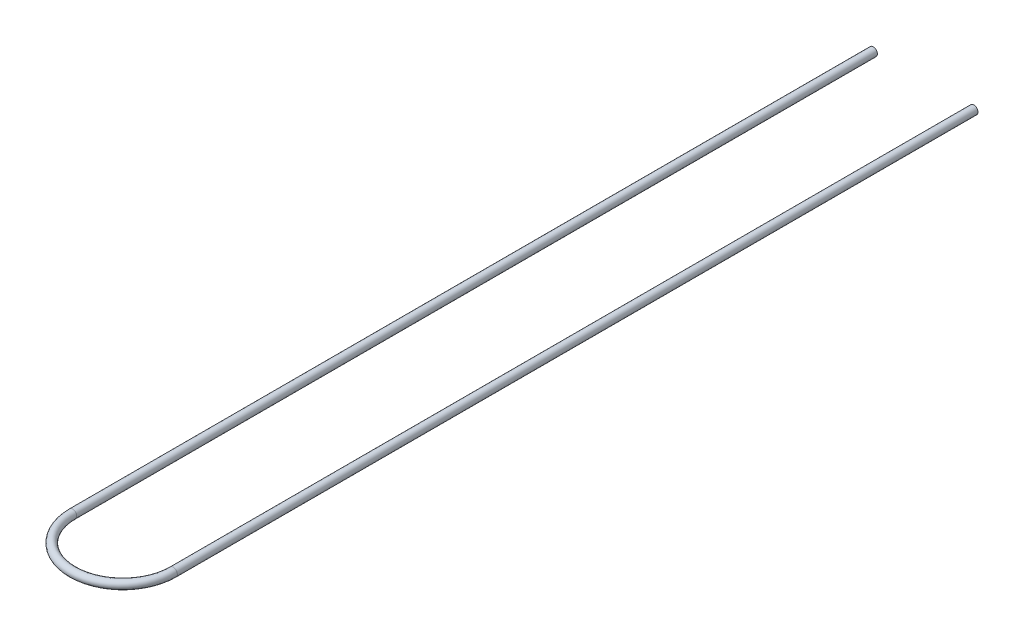
from build123d import *

# Parameters (mm, degrees)
SKETCH2_R   = 11.1
SKETCH2_R_2 = 9.95


with BuildPart() as part:
    # Sweep1: sweep along a path in Sketch1
    with BuildLine(Plane(origin=(0, 0, 0), x_dir=(1, 0, 0), z_dir=(0, 1, 0))) as sweep1_path:
        Line((228.93, -300), (228.93, -2440))
        ThreePointArc((228.93, -2440), (94.465, -2574.465), (-40, -2440))
        Line((-40, -2440), (-40, -300))
    # Sketch2 → Sweep1 (sweep)
    with BuildSketch(Plane(origin=(228.93, 0, 300), x_dir=(-1, 0, 0), z_dir=(0, 0, -1))):
        Circle(SKETCH2_R)
        Circle(SKETCH2_R_2, mode=Mode.SUBTRACT)
    sweep(path=sweep1_path.line)


solid = part.part
